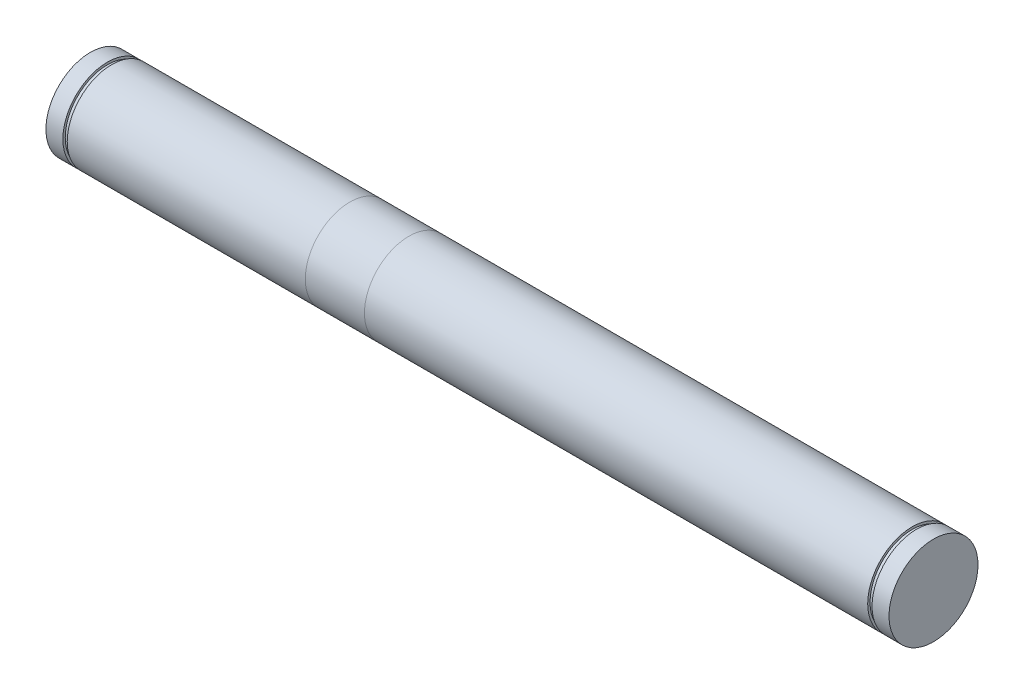
from build123d import *

# Parameters (mm, degrees)
SKIZZE19_W = 1.85
SKIZZE19_H = 1
SKIZZE20_W = 1.85
SKIZZE20_H = 1
SKETCH1_W  = 14.101371306
SKETCH1_H  = 11.293421516


with BuildPart() as part:
    # Skizze1 → Rotation1 (revolve)
    with BuildSketch(Plane.XY, mode=Mode.PRIVATE) as rotation1_sk:
        Polygon((180, 19), (180, 0), (-180, 0), (-180, 19), (-79, 19), (-79, 27), (-74, 27), (-74, 19.001), (-44, 19.001), (-44, 19), align=None)
    revolve(rotation1_sk.sketch.rotate(Axis((180, 0, 0), (-1, 0, 0)), 90), axis=Axis((180, 0, 0), (-1, 0, 0)))

    # Skizze19 → Schnitt-Rotation1 (revolve, cut)
    with BuildSketch(Plane.XY, mode=Mode.PRIVATE) as schnitt_rotation1_sk:
        with Locations((171.825, 18.5)):
            Rectangle(SKIZZE19_W, SKIZZE19_H)
    revolve(schnitt_rotation1_sk.sketch.rotate(Axis((-88.99, 0, 0), (1, 0, 0)), 270), axis=Axis((-88.99, 0, 0), (1, 0, 0)), mode=Mode.SUBTRACT)

    # Skizze20 → Schnitt-Rotation2 (revolve, cut)
    with BuildSketch(Plane.XY, mode=Mode.PRIVATE) as schnitt_rotation2_sk:
        with Locations((-171.825, 18.5)):
            Rectangle(SKIZZE20_W, SKIZZE20_H)
    revolve(schnitt_rotation2_sk.sketch.rotate(Axis((-88.99, 0, 0), (1, 0, 0)), 270), axis=Axis((-88.99, 0, 0), (1, 0, 0)), mode=Mode.SUBTRACT)

    # Sketch1 → Cut-Revolve1 (revolve, cut)
    with BuildSketch(Plane.XY, mode=Mode.PRIVATE) as cut_revolve1_sk:
        with Locations((-76.280304753, 24.646710758)):
            Rectangle(SKETCH1_W, SKETCH1_H)
    revolve(cut_revolve1_sk.sketch.rotate(Axis((-191.164691911, 0, 0), (1, 0, 0)), 90), axis=Axis((-191.164691911, 0, 0), (1, 0, 0)), mode=Mode.SUBTRACT)


solid = part.part
